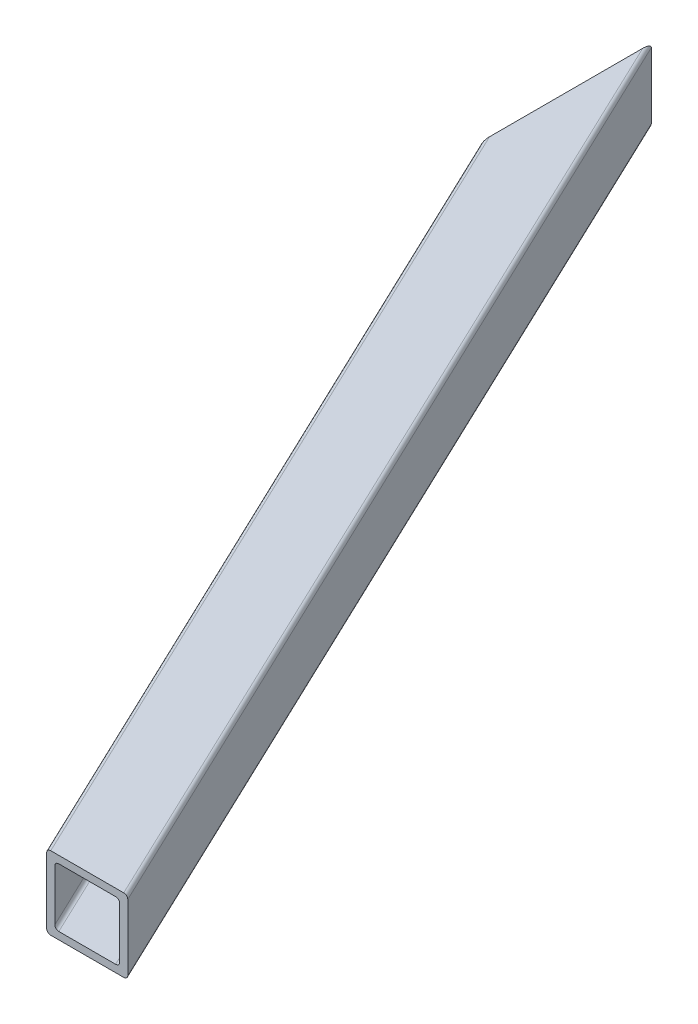
from build123d import *

# Parameters (mm, degrees)
BOSS_EXTRU_1_DEPTH           = 40
COQUE1_T                     = 4
ENL_V_MAT_EXTRU_1_DEPTH      = 669.291236076
ENL_V_MAT_EXTRU_1_DEPTH_BACK = 669.291236076
ESQUISSE2_W                  = 32
ESQUISSE2_H                  = 32
CONG_1_R                     = 2


with BuildPart() as part:
    # Esquisse1 → Boss.-Extru.1 (new body)
    with BuildSketch(Plane(origin=(0, 0, 0), x_dir=(1, 0, 0), z_dir=(0, 1, 0))):
        Polygon((0, 452.962373203), (215.696368192, 0), (260, 0), (0, 546), align=None)
    extrude(amount=BOSS_EXTRU_1_DEPTH)

    # Coque1 (no face opened: a closed hollow body)
    add(offset(amount=-COQUE1_T, mode=Mode.PRIVATE), mode=Mode.SUBTRACT)

    # Esquisse2 → Enlèv. mat.-Extru.1 (cut, two sides: drawn at the far end of the back side and taken through both)
    with BuildSketch(Plane(origin=(39.869938668, 0, 83.726871202), x_dir=(0, -1, 0), z_dir=(-0.42993358039234786, 0, -0.9028605188239303)).offset(-ENL_V_MAT_EXTRU_1_DEPTH_BACK)):
        with Locations((-20, -214.743734894)):
            Rectangle(ESQUISSE2_W, ESQUISSE2_H)
    extrude(amount=ENL_V_MAT_EXTRU_1_DEPTH + ENL_V_MAT_EXTRU_1_DEPTH_BACK, mode=Mode.SUBTRACT)

    # Congé1
    cong_1_edges = [part.edges().sort_by_distance(p)[0] for p in [
        (130, 40, -273),
        (110.063365686, 4, -231.133067941),
        (127.78481841, 4, -268.34811866),
        (110.063365686, 36, -231.133067941),
        (127.78481841, 36, -268.34811866),
        (130, 0, -273),
        (107.848184096, 0, -226.481186602),
        (107.848184096, 40, -226.481186602),
    ]]
    fillet(cong_1_edges, radius=CONG_1_R)


solid = part.part
